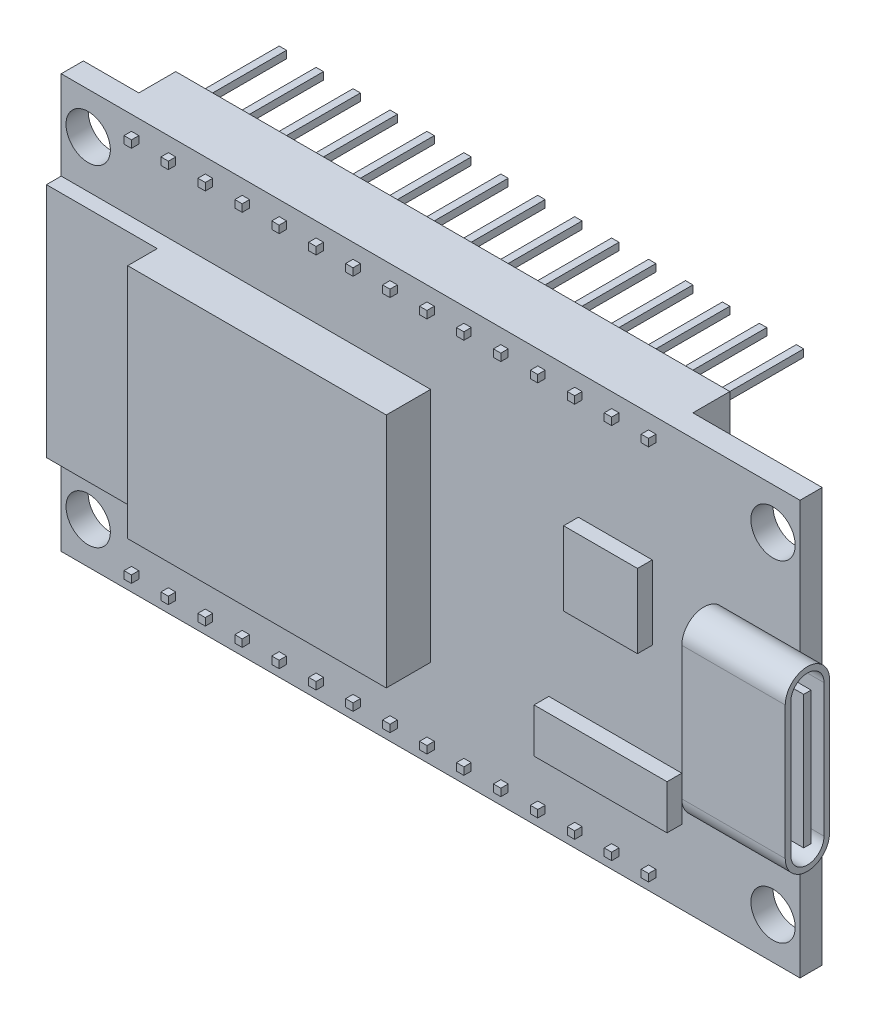
from build123d import *

# Parameters (mm, degrees)
SKETCH1_W                = 50
SKETCH1_H                = 28
SKETCH1_R                = 1.5
BOSS_EXTRUDE1_DEPTH      = 0.75
BOSS_EXTRUDE2_DEPTH      = 7
SKETCH8_W                = 0.5
SKETCH8_H                = 0.5
SKETCH8_W_2              = 37.5
SKETCH8_H_2              = 2.5
BOSS_EXTRUDE3_DEPTH      = 4
BOSS_EXTRUDE4_START      = -10
SKETCH8_3_W              = 0.5
SKETCH8_3_H              = 0.5
BOSS_EXTRUDE4_DEPTH      = 10.5
LPATTERN1_COUNT          = 15
LPATTERN1_PITCH          = 2.5
MIRROR1_START            = -10
MIRROR1_COPY_1_SKETCH_W  = 0.5
MIRROR1_COPY_1_SKETCH_H  = 0.5
MIRROR1_COPY_1_DEPTH     = 10.5
MIRROR1_COPY_2_SKETCH_W  = 0.5
MIRROR1_COPY_2_SKETCH_H  = 0.5
MIRROR1_COPY_2_DEPTH     = 10.5
MIRROR1_COPY_3_SKETCH_W  = 0.5
MIRROR1_COPY_3_SKETCH_H  = 0.5
MIRROR1_COPY_3_DEPTH     = 10.5
MIRROR1_COPY_4_SKETCH_W  = 0.5
MIRROR1_COPY_4_SKETCH_H  = 0.5
MIRROR1_COPY_4_DEPTH     = 10.5
MIRROR1_COPY_5_SKETCH_W  = 0.5
MIRROR1_COPY_5_SKETCH_H  = 0.5
MIRROR1_COPY_5_DEPTH     = 10.5
MIRROR1_COPY_6_SKETCH_W  = 0.5
MIRROR1_COPY_6_SKETCH_H  = 0.5
MIRROR1_COPY_6_DEPTH     = 10.5
MIRROR1_COPY_7_SKETCH_W  = 0.5
MIRROR1_COPY_7_SKETCH_H  = 0.5
MIRROR1_COPY_7_DEPTH     = 10.5
MIRROR1_COPY_8_SKETCH_W  = 0.5
MIRROR1_COPY_8_SKETCH_H  = 0.5
MIRROR1_COPY_8_DEPTH     = 10.5
MIRROR1_COPY_9_SKETCH_W  = 0.5
MIRROR1_COPY_9_SKETCH_H  = 0.5
MIRROR1_COPY_9_DEPTH     = 10.5
MIRROR1_COPY_10_SKETCH_W = 0.5
MIRROR1_COPY_10_SKETCH_H = 0.5
MIRROR1_COPY_10_DEPTH    = 10.5
MIRROR1_COPY_11_SKETCH_W = 0.5
MIRROR1_COPY_11_SKETCH_H = 0.5
MIRROR1_COPY_11_DEPTH    = 10.5
MIRROR1_COPY_12_SKETCH_W = 0.5
MIRROR1_COPY_12_SKETCH_H = 0.5
MIRROR1_COPY_12_DEPTH    = 10.5
MIRROR1_COPY_13_SKETCH_W = 0.5
MIRROR1_COPY_13_SKETCH_H = 0.5
MIRROR1_COPY_13_DEPTH    = 10.5
MIRROR1_COPY_14_SKETCH_W = 0.5
MIRROR1_COPY_14_SKETCH_H = 0.5
MIRROR1_COPY_14_DEPTH    = 10.5
MIRROR1_COPY_15_SKETCH_W = 0.5
MIRROR1_COPY_15_SKETCH_H = 0.5
MIRROR1_COPY_15_DEPTH    = 10.5
SKETCH8_4_W              = 17.5
SKETCH8_4_H              = 16
BOSS_EXTRUDE5_DEPTH      = 3
SKETCH8_5_W              = 7.5
SKETCH8_5_H              = 16
SKETCH8_5_W_2            = 5
SKETCH8_5_H_2            = 5
SKETCH8_5_W_3            = 9
SKETCH8_5_H_3            = 3
BOSS_EXTRUDE6_DEPTH      = 1
SKETCH6_W                = 0.5
SKETCH6_H                = 9
CUT_EXTRUDE4_DEPTH       = 6


with BuildPart() as part:
    # Sketch1 → Boss-Extrude1 (new, symmetric)
    with BuildSketch(Plane.XY):
        Rectangle(SKETCH1_W, SKETCH1_H)
        with Locations((23.174404931, 11.201220244)):
            Circle(SKETCH1_R, mode=Mode.SUBTRACT)
        with Locations((23.174404931, -11.201220244)):
            Circle(SKETCH1_R, mode=Mode.SUBTRACT)
        with Locations((-23.174404931, 11.201220244)):
            Circle(SKETCH1_R, mode=Mode.SUBTRACT)
        with Locations((-23.174404931, -11.201220244)):
            Circle(SKETCH1_R, mode=Mode.SUBTRACT)
    extrude(amount=BOSS_EXTRUDE1_DEPTH, both=True)

    # Sketch5 → Boss-Extrude2 (add)
    with BuildSketch(Plane(origin=(27, 0, 0), x_dir=(0, 0, -1), z_dir=(1, 0, 0))):
        with BuildLine():
            Line((-3.75, 4.5), (-3.75, -4.5))
            ThreePointArc((-3.75, -4.5), (-2.25, -6), (-0.75, -4.5))
            Line((-0.75, -4.5), (-0.75, 0))
            Line((-0.75, 0), (-0.75, 4.5))
            ThreePointArc((-0.75, 4.5), (-2.25, 6), (-3.75, 4.5))
        make_face()
    extrude(amount=-BOSS_EXTRUDE2_DEPTH)

    # Sketch8 → Boss-Extrude3 (add)
    # profile 1 of 2: a face of its own
    with BuildSketch(Plane.XY.offset(0.75)):
        Polygon((16.25, 11.5), (16.25, 14), (15, 14), (-21.25, 14), (-21.25, 11.5), align=None)
        with Locations((-17.5, 12.75)):
            Rectangle(SKETCH8_W, SKETCH8_H, mode=Mode.SUBTRACT)
        with Locations((-20, 12.75)):
            Rectangle(SKETCH8_W, SKETCH8_H, mode=Mode.SUBTRACT)
        with Locations((-15, 12.75)):
            Rectangle(SKETCH8_W, SKETCH8_H, mode=Mode.SUBTRACT)
        with Locations((-12.5, 12.75)):
            Rectangle(SKETCH8_W, SKETCH8_H, mode=Mode.SUBTRACT)
        with Locations((-10, 12.75)):
            Rectangle(SKETCH8_W, SKETCH8_H, mode=Mode.SUBTRACT)
        with Locations((-7.5, 12.75)):
            Rectangle(SKETCH8_W, SKETCH8_H, mode=Mode.SUBTRACT)
        with Locations((-5, 12.75)):
            Rectangle(SKETCH8_W, SKETCH8_H, mode=Mode.SUBTRACT)
        with Locations((0, 12.75)):
            Rectangle(SKETCH8_W, SKETCH8_H, mode=Mode.SUBTRACT)
        with Locations((2.5, 12.75)):
            Rectangle(SKETCH8_W, SKETCH8_H, mode=Mode.SUBTRACT)
        with Locations((5, 12.75)):
            Rectangle(SKETCH8_W, SKETCH8_H, mode=Mode.SUBTRACT)
        with Locations((7.5, 12.75)):
            Rectangle(SKETCH8_W, SKETCH8_H, mode=Mode.SUBTRACT)
        with Locations((10, 12.75)):
            Rectangle(SKETCH8_W, SKETCH8_H, mode=Mode.SUBTRACT)
        with Locations((12.5, 12.75)):
            Rectangle(SKETCH8_W, SKETCH8_H, mode=Mode.SUBTRACT)
        Polygon((14.75, 13), (15, 13), (15.25, 13), (15.25, 12.5), (14.75, 12.5), align=None, mode=Mode.SUBTRACT)
    # profile 2 of 2: a face of its own
    with BuildSketch(Plane.XY.offset(0.75)):
        with Locations((-2.5, -12.75)):
            Rectangle(SKETCH8_W_2, SKETCH8_H_2)
        with Locations((15, -12.75)):
            Rectangle(SKETCH8_W, SKETCH8_H, mode=Mode.SUBTRACT)
        with Locations((12.5, -12.75)):
            Rectangle(SKETCH8_W, SKETCH8_H, mode=Mode.SUBTRACT)
        with Locations((10, -12.75)):
            Rectangle(SKETCH8_W, SKETCH8_H, mode=Mode.SUBTRACT)
        with Locations((7.5, -12.75)):
            Rectangle(SKETCH8_W, SKETCH8_H, mode=Mode.SUBTRACT)
        with Locations((5, -12.75)):
            Rectangle(SKETCH8_W, SKETCH8_H, mode=Mode.SUBTRACT)
        with Locations((2.5, -12.75)):
            Rectangle(SKETCH8_W, SKETCH8_H, mode=Mode.SUBTRACT)
        with Locations((0, -12.75)):
            Rectangle(SKETCH8_W, SKETCH8_H, mode=Mode.SUBTRACT)
        with Locations((-2.5, -12.75)):
            Rectangle(SKETCH8_W, SKETCH8_H, mode=Mode.SUBTRACT)
        with Locations((-5, -12.75)):
            Rectangle(SKETCH8_W, SKETCH8_H, mode=Mode.SUBTRACT)
        with Locations((-7.5, -12.75)):
            Rectangle(SKETCH8_W, SKETCH8_H, mode=Mode.SUBTRACT)
        with Locations((-10, -12.75)):
            Rectangle(SKETCH8_W, SKETCH8_H, mode=Mode.SUBTRACT)
        with Locations((-12.5, -12.75)):
            Rectangle(SKETCH8_W, SKETCH8_H, mode=Mode.SUBTRACT)
        with Locations((-15, -12.75)):
            Rectangle(SKETCH8_W, SKETCH8_H, mode=Mode.SUBTRACT)
        with Locations((-17.5, -12.75)):
            Rectangle(SKETCH8_W, SKETCH8_H, mode=Mode.SUBTRACT)
        with Locations((-20, -12.75)):
            Rectangle(SKETCH8_W, SKETCH8_H, mode=Mode.SUBTRACT)
    extrude(amount=-BOSS_EXTRUDE3_DEPTH)

    # Sketch8<3> → Boss-Extrude4 (add)
    with BuildSketch(Plane.XY.offset(0.75).offset(BOSS_EXTRUDE4_START)):
        with Locations((15, -12.75)):
            Rectangle(SKETCH8_3_W, SKETCH8_3_H)
    boss_extrude4 = extrude(amount=BOSS_EXTRUDE4_DEPTH)

    # LPattern1: Boss-Extrude4 ×15
    with Locations(*[(-i * LPATTERN1_PITCH, 0, 0) for i in range(1, LPATTERN1_COUNT)]):
        add(boss_extrude4)

    # Mirror1 copy 1 sketch → Mirror1 copy 1 (add)
    with BuildSketch(Plane(origin=(-2.5, 0, 0.75), x_dir=(1, 0, 0), z_dir=(0, 0, 1)).offset(MIRROR1_START)):
        with Locations((15, 12.75)):
            Rectangle(MIRROR1_COPY_1_SKETCH_W, MIRROR1_COPY_1_SKETCH_H)
    extrude(amount=MIRROR1_COPY_1_DEPTH)

    # Mirror1 copy 2 sketch → Mirror1 copy 2 (add)
    with BuildSketch(Plane(origin=(-5, 0, 0.75), x_dir=(1, 0, 0), z_dir=(0, 0, 1)).offset(MIRROR1_START)):
        with Locations((15, 12.75)):
            Rectangle(MIRROR1_COPY_2_SKETCH_W, MIRROR1_COPY_2_SKETCH_H)
    extrude(amount=MIRROR1_COPY_2_DEPTH)

    # Mirror1 copy 3 sketch → Mirror1 copy 3 (add)
    with BuildSketch(Plane(origin=(-7.5, 0, 0.75), x_dir=(1, 0, 0), z_dir=(0, 0, 1)).offset(MIRROR1_START)):
        with Locations((15, 12.75)):
            Rectangle(MIRROR1_COPY_3_SKETCH_W, MIRROR1_COPY_3_SKETCH_H)
    extrude(amount=MIRROR1_COPY_3_DEPTH)

    # Mirror1 copy 4 sketch → Mirror1 copy 4 (add)
    with BuildSketch(Plane(origin=(-10, 0, 0.75), x_dir=(1, 0, 0), z_dir=(0, 0, 1)).offset(MIRROR1_START)):
        with Locations((15, 12.75)):
            Rectangle(MIRROR1_COPY_4_SKETCH_W, MIRROR1_COPY_4_SKETCH_H)
    extrude(amount=MIRROR1_COPY_4_DEPTH)

    # Mirror1 copy 5 sketch → Mirror1 copy 5 (add)
    with BuildSketch(Plane(origin=(-12.5, 0, 0.75), x_dir=(1, 0, 0), z_dir=(0, 0, 1)).offset(MIRROR1_START)):
        with Locations((15, 12.75)):
            Rectangle(MIRROR1_COPY_5_SKETCH_W, MIRROR1_COPY_5_SKETCH_H)
    extrude(amount=MIRROR1_COPY_5_DEPTH)

    # Mirror1 copy 6 sketch → Mirror1 copy 6 (add)
    with BuildSketch(Plane(origin=(-15, 0, 0.75), x_dir=(1, 0, 0), z_dir=(0, 0, 1)).offset(MIRROR1_START)):
        with Locations((15, 12.75)):
            Rectangle(MIRROR1_COPY_6_SKETCH_W, MIRROR1_COPY_6_SKETCH_H)
    extrude(amount=MIRROR1_COPY_6_DEPTH)

    # Mirror1 copy 7 sketch → Mirror1 copy 7 (add)
    with BuildSketch(Plane(origin=(-17.5, 0, 0.75), x_dir=(1, 0, 0), z_dir=(0, 0, 1)).offset(MIRROR1_START)):
        with Locations((15, 12.75)):
            Rectangle(MIRROR1_COPY_7_SKETCH_W, MIRROR1_COPY_7_SKETCH_H)
    extrude(amount=MIRROR1_COPY_7_DEPTH)

    # Mirror1 copy 8 sketch → Mirror1 copy 8 (add)
    with BuildSketch(Plane(origin=(-20, 0, 0.75), x_dir=(1, 0, 0), z_dir=(0, 0, 1)).offset(MIRROR1_START)):
        with Locations((15, 12.75)):
            Rectangle(MIRROR1_COPY_8_SKETCH_W, MIRROR1_COPY_8_SKETCH_H)
    extrude(amount=MIRROR1_COPY_8_DEPTH)

    # Mirror1 copy 9 sketch → Mirror1 copy 9 (add)
    with BuildSketch(Plane(origin=(-22.5, 0, 0.75), x_dir=(1, 0, 0), z_dir=(0, 0, 1)).offset(MIRROR1_START)):
        with Locations((15, 12.75)):
            Rectangle(MIRROR1_COPY_9_SKETCH_W, MIRROR1_COPY_9_SKETCH_H)
    extrude(amount=MIRROR1_COPY_9_DEPTH)

    # Mirror1 copy 10 sketch → Mirror1 copy 10 (add)
    with BuildSketch(Plane(origin=(-25, 0, 0.75), x_dir=(1, 0, 0), z_dir=(0, 0, 1)).offset(MIRROR1_START)):
        with Locations((15, 12.75)):
            Rectangle(MIRROR1_COPY_10_SKETCH_W, MIRROR1_COPY_10_SKETCH_H)
    extrude(amount=MIRROR1_COPY_10_DEPTH)

    # Mirror1 copy 11 sketch → Mirror1 copy 11 (add)
    with BuildSketch(Plane(origin=(-27.5, 0, 0.75), x_dir=(1, 0, 0), z_dir=(0, 0, 1)).offset(MIRROR1_START)):
        with Locations((15, 12.75)):
            Rectangle(MIRROR1_COPY_11_SKETCH_W, MIRROR1_COPY_11_SKETCH_H)
    extrude(amount=MIRROR1_COPY_11_DEPTH)

    # Mirror1 copy 12 sketch → Mirror1 copy 12 (add)
    with BuildSketch(Plane(origin=(-30, 0, 0.75), x_dir=(1, 0, 0), z_dir=(0, 0, 1)).offset(MIRROR1_START)):
        with Locations((15, 12.75)):
            Rectangle(MIRROR1_COPY_12_SKETCH_W, MIRROR1_COPY_12_SKETCH_H)
    extrude(amount=MIRROR1_COPY_12_DEPTH)

    # Mirror1 copy 13 sketch → Mirror1 copy 13 (add)
    with BuildSketch(Plane(origin=(-32.5, 0, 0.75), x_dir=(1, 0, 0), z_dir=(0, 0, 1)).offset(MIRROR1_START)):
        with Locations((15, 12.75)):
            Rectangle(MIRROR1_COPY_13_SKETCH_W, MIRROR1_COPY_13_SKETCH_H)
    extrude(amount=MIRROR1_COPY_13_DEPTH)

    # Mirror1 copy 14 sketch → Mirror1 copy 14 (add)
    with BuildSketch(Plane(origin=(-35, 0, 0.75), x_dir=(1, 0, 0), z_dir=(0, 0, 1)).offset(MIRROR1_START)):
        with Locations((15, 12.75)):
            Rectangle(MIRROR1_COPY_14_SKETCH_W, MIRROR1_COPY_14_SKETCH_H)
    extrude(amount=MIRROR1_COPY_14_DEPTH)

    # Mirror1 copy 15 sketch → Mirror1 copy 15 (add)
    with BuildSketch(Plane.XY.offset(0.75).offset(MIRROR1_START)):
        with Locations((15, 12.75)):
            Rectangle(MIRROR1_COPY_15_SKETCH_W, MIRROR1_COPY_15_SKETCH_H)
    extrude(amount=MIRROR1_COPY_15_DEPTH)

    # Sketch8<4> → Boss-Extrude5 (add)
    with BuildSketch(Plane.XY.offset(0.75)):
        with Locations((-8.75, 0)):
            Rectangle(SKETCH8_4_W, SKETCH8_4_H)
    extrude(amount=BOSS_EXTRUDE5_DEPTH)

    # Sketch8<5> → Boss-Extrude6 (add)
    with BuildSketch(Plane.XY.offset(0.75)):
        with Locations((-21.25, 0)):
            Rectangle(SKETCH8_5_W, SKETCH8_5_H)
        with Locations((12.5, 3.006377204)):
            Rectangle(SKETCH8_5_W_2, SKETCH8_5_H_2)
        with Locations((12.5, -7.495049505)):
            Rectangle(SKETCH8_5_W_3, SKETCH8_5_H_3)
    extrude(amount=BOSS_EXTRUDE6_DEPTH)

    # Sketch6 → Cut-Extrude4 (cut)
    with BuildSketch(Plane(origin=(27, 0, 0), x_dir=(0, 0, -1), z_dir=(1, 0, 0))):
        with BuildLine():
            ThreePointArc((-1.125, 4.5), (-2.25, 5.625), (-3.375, 4.5))
            Line((-3.375, 4.5), (-3.375, -4.5))
            ThreePointArc((-3.375, -4.5), (-2.25, -5.625), (-1.125, -4.5))
            Line((-1.125, -4.5), (-1.125, 4.5))
        make_face()
        with Locations((-2.25, 0)):
            Rectangle(SKETCH6_W, SKETCH6_H, mode=Mode.SUBTRACT)
    extrude(amount=-CUT_EXTRUDE4_DEPTH, mode=Mode.SUBTRACT)


solid = part.part
